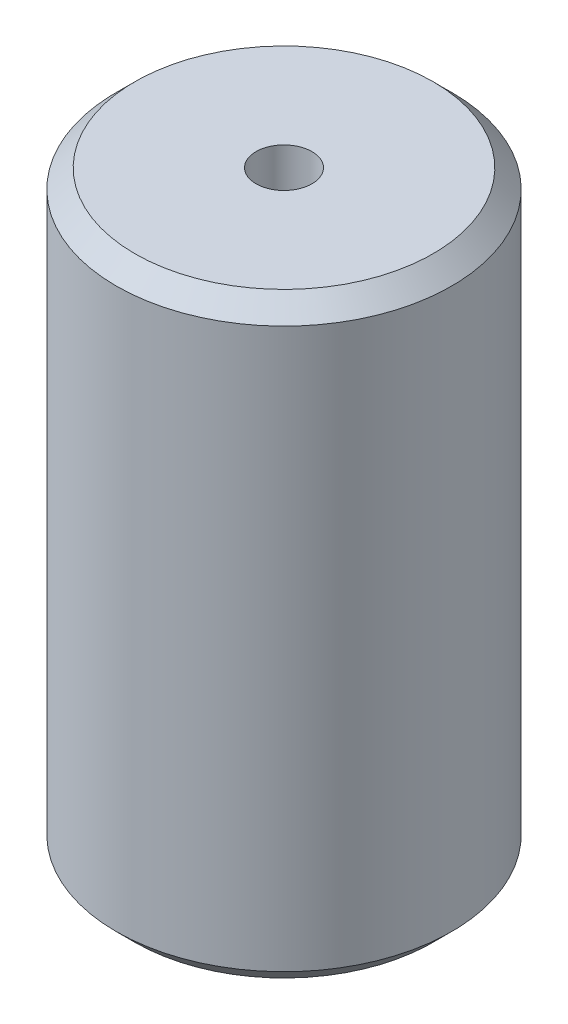
from build123d import *

# Parameters (mm, degrees)
SKETCH1_R           = 9
SKETCH1_R_2         = 1.5
BOSS_EXTRUDE1_DEPTH = 32
CHAMFER1_SIZE       = 1


with BuildPart() as part:
    # Sketch1 → Boss-Extrude1 (new body)
    with BuildSketch(Plane(origin=(0, 0, 0), x_dir=(1, 0, 0), z_dir=(0, 1, 0))):
        with Locations(Location((0, 0, 0), (0, 0, 270))):
            Circle(SKETCH1_R)
        with Locations(Location((0, 0, 0), (0, 0, 270))):
            Circle(SKETCH1_R_2, mode=Mode.SUBTRACT)
    extrude(amount=BOSS_EXTRUDE1_DEPTH)

    # Chamfer1
    chamfer1_edges = [part.edges().sort_by_distance(p)[0] for p in [
        (0, 0, -9),
        (0, 32, -9),
    ]]
    chamfer(chamfer1_edges, length=CHAMFER1_SIZE)


solid = part.part
